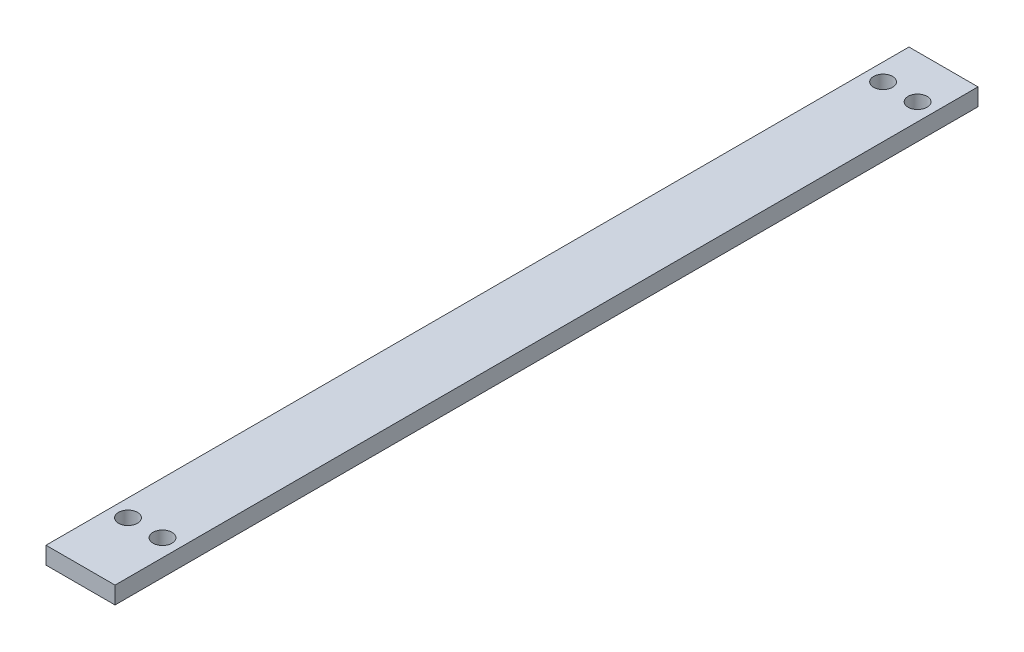
from build123d import *

# Parameters (mm, degrees)
SKETCH_1_W      = 16
SKETCH_1_H      = 200
SKETCH_1_R      = 2.2
EXTRUDE_1_DEPTH = 4


with BuildPart() as part:
    # 草图1 → 凸台-拉伸1 (new body)
    with BuildSketch(Plane(origin=(0, 0, 0), x_dir=(1, 0, 0), z_dir=(0, 1, 0))):
        with Locations((8, 100)):
            Rectangle(SKETCH_1_W, SKETCH_1_H)
        with Locations(Location((12, 190, 0), (0, 0, 270))):
            Circle(SKETCH_1_R, mode=Mode.SUBTRACT)
        with Locations(Location((4, 190, 0), (0, 0, 270))):
            Circle(SKETCH_1_R, mode=Mode.SUBTRACT)
        with Locations(Location((4, 15, 0), (0, 0, 270))):
            Circle(SKETCH_1_R, mode=Mode.SUBTRACT)
        with Locations(Location((12, 15, 0), (0, 0, 270))):
            Circle(SKETCH_1_R, mode=Mode.SUBTRACT)
    extrude(amount=EXTRUDE_1_DEPTH)


solid = part.part
